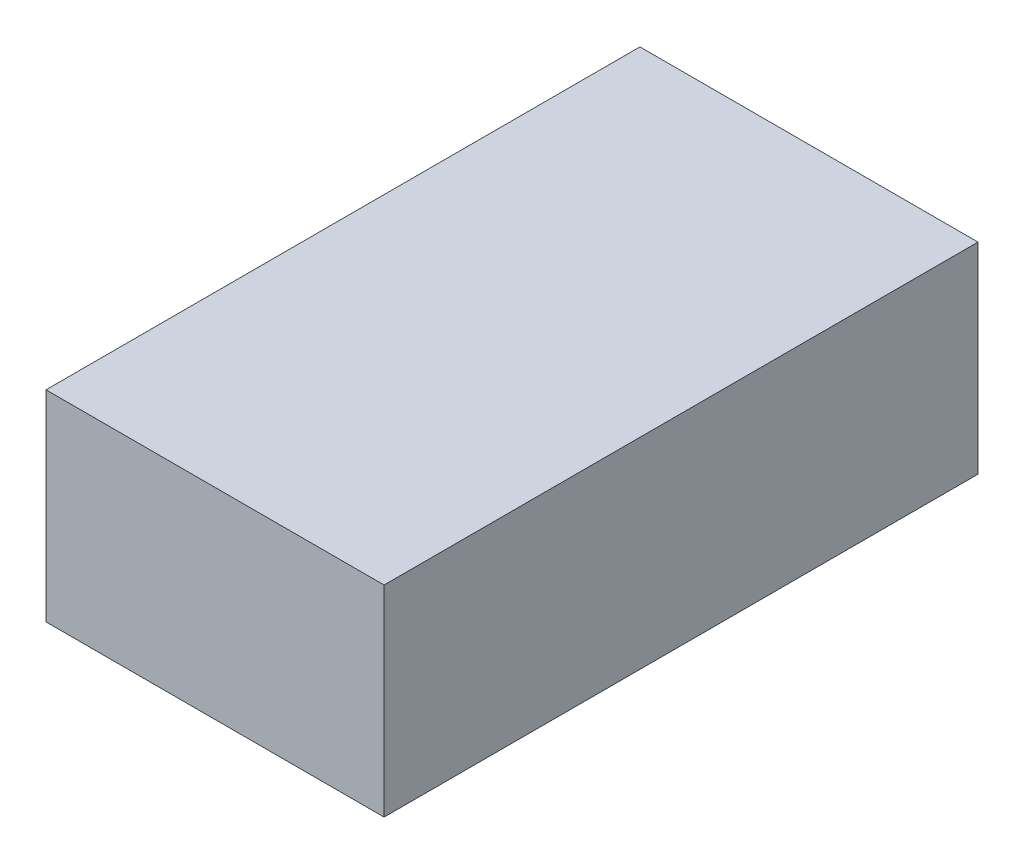
from build123d import *

# Parameters (mm, degrees)
SKETCH1_W           = 37
SKETCH1_H           = 22
BOSS_EXTRUDE1_DEPTH = 32.5


with BuildPart() as part:
    # Sketch1 → Boss-Extrude1 (new, symmetric)
    with BuildSketch(Plane.XY):
        Rectangle(SKETCH1_W, SKETCH1_H)
    extrude(amount=BOSS_EXTRUDE1_DEPTH, both=True)


solid = part.part
